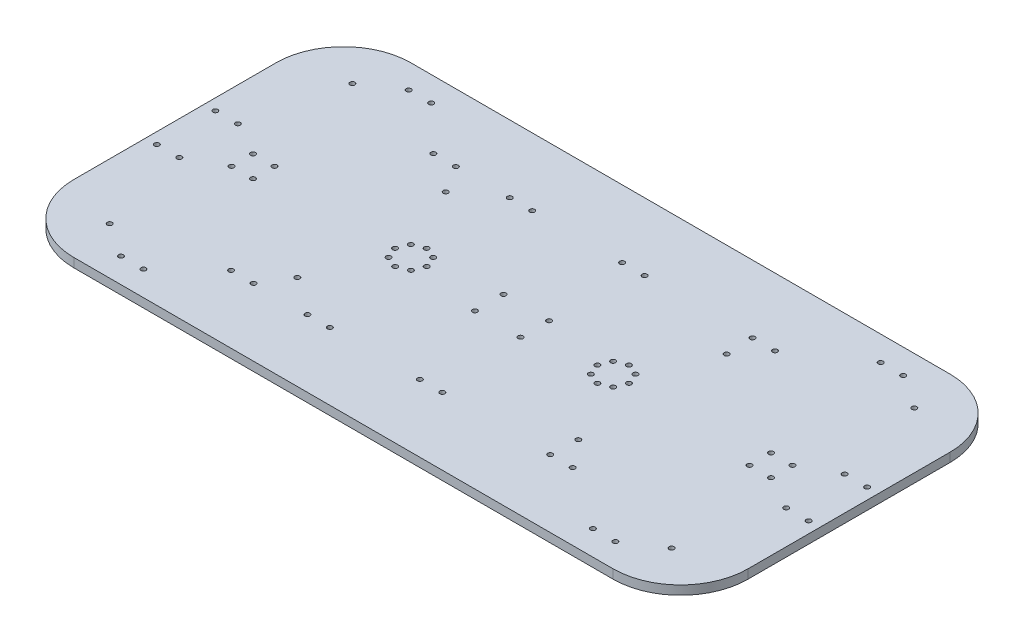
from build123d import *

# Parameters (mm, degrees)
SKETCH_1_W                            = 300
SKETCH_1_H                            = 150
EXTRUDE_1_DEPTH                       = 4
FILLET_4_R                            = 30
FILLET_5_R                            = 30
FILLET_6_R                            = 30
FILLET_7_R                            = 30
HOLE_WIZARD_2_2_2_2_1_D               = 2.2
PATTERN_CIRCULAR_1_COUNT              = 8
MIRROR_1_COPY_1_D                     = 2.2
MIRROR_1_COPY_2_D                     = 2.2
MIRROR_1_COPY_3_D                     = 2.2
MIRROR_1_COPY_4_D                     = 2.2
MIRROR_1_COPY_5_D                     = 2.2
MIRROR_1_COPY_6_D                     = 2.2
MIRROR_1_COPY_7_D                     = 2.2
HOLE_WIZARD_2_2_2_2_2_D               = 2.2
HOLE_WIZARD_2_2_2_2_4_D               = 2.2
F_2_2_2_2_DIAMETER_HOLE1_D            = 2.2
MIRROR_5_AT_THE_SECOND_PLANE_COPY_1_D = 2.2
HOLE_WIZARD_2_2_2_2_6_D               = 2.2
F_2_2_2_2_DIAMETER_HOLE2_D            = 2.2
MIRROR_6_AT_THE_SECOND_PLANE_COPY_1_D = 2.2
F_2_2_2_2_DIAMETER_HOLE3_D            = 2.2
F_2_2_2_2_DIAMETER_HOLE4_D            = 2.2
MIRROR_8_AT_THE_SECOND_PLANE_COPY_1_D = 2.2


with BuildPart() as part:
    # 草图1 → 凸台-拉伸1 (new body)
    with BuildSketch(Plane(origin=(0, 0, 0), x_dir=(1, 0, 0), z_dir=(0, 1, 0))):
        Rectangle(SKETCH_1_W, SKETCH_1_H)
    extrude(amount=EXTRUDE_1_DEPTH)

    # 圆角4
    fillet_4_edges = [part.edges().sort_by_distance(p)[0] for p in [
        (-150, 2, 75),
    ]]
    fillet(fillet_4_edges, radius=FILLET_4_R)

    # 圆角5
    fillet_5_edges = [part.edges().sort_by_distance(p)[0] for p in [
        (-150, 2, -75),
    ]]
    fillet(fillet_5_edges, radius=FILLET_5_R)

    # 圆角6
    fillet_6_edges = [part.edges().sort_by_distance(p)[0] for p in [
        (150, 2, -75),
    ]]
    fillet(fillet_6_edges, radius=FILLET_6_R)

    # 圆角7
    fillet_7_edges = [part.edges().sort_by_distance(p)[0] for p in [
        (150, 2, 75),
    ]]
    fillet(fillet_7_edges, radius=FILLET_7_R)

    # Ø2.2 (2.2) 直径孔1 (through all)
    with Locations(Plane(origin=(0, 0, 0), x_dir=(-1, 0, 0), z_dir=(0, -1, 0))):
        with Locations((45, -7.02)):
            hole_wizard_2_2_2_2_1 = Hole(HOLE_WIZARD_2_2_2_2_1_D / 2)

    # 阵列(圆周)1: Ø2.2 (2.2) 直径孔1 ×8 about axis
    pattern_circular_1_axis = Axis((-45, 0, 0), (0, 1, 0))
    for i in range(1, PATTERN_CIRCULAR_1_COUNT):
        add(hole_wizard_2_2_2_2_1.rotate(pattern_circular_1_axis, i * 360 / PATTERN_CIRCULAR_1_COUNT), mode=Mode.SUBTRACT)

    # 镜向1: Ø2.2 (2.2) 直径孔1 across plane
    add(hole_wizard_2_2_2_2_1.mirror(Plane(origin=(0, 0, 0), x_dir=(0, 0, 1), z_dir=(1, 0, 0))), mode=Mode.SUBTRACT)

    # 镜向1 copy 1 (through all)
    with Locations(Plane(origin=(13.180194847, 0, -31.819805153), x_dir=(0.7071067811865476, 0, 0.7071067811865475), z_dir=(0, -1, 0))):
        with Locations((45, 7.02)):
            Hole(MIRROR_1_COPY_1_D / 2)

    # 镜向1 copy 2 (through all)
    with Locations(Plane(origin=(45, 0, -45), x_dir=(0, 0, 1), z_dir=(0, -1, 0))):
        with Locations((45, 7.02)):
            Hole(MIRROR_1_COPY_2_D / 2)

    # 镜向1 copy 3 (through all)
    with Locations(Plane(origin=(76.819805153, 0, -31.819805153), x_dir=(-0.7071067811865475, 0, 0.7071067811865476), z_dir=(0, -1, 0))):
        with Locations((45, 7.02)):
            Hole(MIRROR_1_COPY_3_D / 2)

    # 镜向1 copy 4 (through all)
    with Locations(Plane(origin=(90, 0, 0), x_dir=(-1, 0, 0), z_dir=(0, -1, 0))):
        with Locations((45, 7.02)):
            Hole(MIRROR_1_COPY_4_D / 2)

    # 镜向1 copy 5 (through all)
    with Locations(Plane(origin=(76.819805153, 0, 31.819805153), x_dir=(-0.7071067811865477, 0, -0.7071067811865475), z_dir=(0, -1, 0))):
        with Locations((45, 7.02)):
            Hole(MIRROR_1_COPY_5_D / 2)

    # 镜向1 copy 6 (through all)
    with Locations(Plane(origin=(45, 0, 45), x_dir=(0, 0, -1), z_dir=(0, -1, 0))):
        with Locations((45, 7.02)):
            Hole(MIRROR_1_COPY_6_D / 2)

    # 镜向1 copy 7 (through all)
    with Locations(Plane(origin=(13.180194847, 0, 31.819805153), x_dir=(0.7071067811865474, 0, -0.7071067811865477), z_dir=(0, -1, 0))):
        with Locations((45, 7.02)):
            Hole(MIRROR_1_COPY_7_D / 2)

    # Ø2.2 (2.2) 直径孔2 (through all)
    with Locations(Plane(origin=(0, 0, 0), x_dir=(-1, 0, 0), z_dir=(0, -1, 0))):
        with Locations((120, 4.78), (120, -4.775), (110.45, -4.775), (110.45, 4.78)):
            hole_wizard_2_2_2_2_2 = Hole(HOLE_WIZARD_2_2_2_2_2_D / 2)

    # 镜向2: Ø2.2 (2.2) 直径孔2 across plane
    add(hole_wizard_2_2_2_2_2.mirror(Plane(origin=(0, 0, 0), x_dir=(0, 0, 1), z_dir=(1, 0, 0))), mode=Mode.SUBTRACT)

    # Ø2.2 (2.2) 直径孔4 (through all)
    with Locations(Plane(origin=(0, 4, 0), x_dir=(1, 0, 0), z_dir=(0, 1, 0))):
        with Locations((100, -64), (110, -64), (-100, -64), (-110, -64)):
            hole_wizard_2_2_2_2_4 = Hole(HOLE_WIZARD_2_2_2_2_4_D / 2)

    # 镜向4: Ø2.2 (2.2) 直径孔4 across plane
    add(hole_wizard_2_2_2_2_4.mirror(Plane.XY), mode=Mode.SUBTRACT)

    # Ø2.2 (2.2) Diameter Hole1 (through all)
    with Locations(Plane(origin=(0, 4, 0), x_dir=(1, 0, 0), z_dir=(0, 1, 0))):
        with Locations((-125, 54)):
            f_2_2_2_2_diameter_hole1 = Hole(F_2_2_2_2_DIAMETER_HOLE1_D / 2)

    # 镜向5: Ø2.2 (2.2) Diameter Hole1 across plane
    add(f_2_2_2_2_diameter_hole1.mirror(Plane(origin=(0, 0, 0), x_dir=(0, 0, 1), z_dir=(1, 0, 0))), mode=Mode.SUBTRACT)

    # 镜向5 at the second plane: Ø2.2 (2.2) Diameter Hole1 across plane
    add(f_2_2_2_2_diameter_hole1.mirror(Plane.XY), mode=Mode.SUBTRACT)

    # 镜向5 at the second plane copy 1 (through all)
    with Locations(Plane(origin=(0, 4, 0), x_dir=(-1, 0, 0), z_dir=(0, 1, 0))):
        with Locations((-125, 54)):
            Hole(MIRROR_5_AT_THE_SECOND_PLANE_COPY_1_D / 2)

    # Ø2.2 (2.2) 直径孔6 (through all)
    with Locations(Plane(origin=(0, 4, 0), x_dir=(1, 0, 0), z_dir=(0, 1, 0))):
        with Locations((-62.5, 33), (-62.5, -33), (62.5, -33), (62.5, 33)):
            Hole(HOLE_WIZARD_2_2_2_2_6_D / 2)

    # Ø2.2 (2.2) Diameter Hole2 (through all)
    with Locations(Plane(origin=(0, 4, 0), x_dir=(1, 0, 0), z_dir=(0, 1, 0))):
        with Locations((-145, 13), (-135, 13)):
            f_2_2_2_2_diameter_hole2 = Hole(F_2_2_2_2_DIAMETER_HOLE2_D / 2)

    # 镜向6: Ø2.2 (2.2) Diameter Hole2 across plane
    add(f_2_2_2_2_diameter_hole2.mirror(Plane(origin=(0, 0, 0), x_dir=(0, 0, 1), z_dir=(1, 0, 0))), mode=Mode.SUBTRACT)

    # 镜向6 at the second plane: Ø2.2 (2.2) Diameter Hole2 across plane
    add(f_2_2_2_2_diameter_hole2.mirror(Plane.XY), mode=Mode.SUBTRACT)

    # 镜向6 at the second plane copy 1 (through all)
    with Locations(Plane(origin=(0, 4, 0), x_dir=(-1, 0, 0), z_dir=(0, 1, 0))):
        with Locations((-145, 13), (-135, 13)):
            Hole(MIRROR_6_AT_THE_SECOND_PLANE_COPY_1_D / 2)

    # Ø2.2 (2.2) Diameter Hole3 (through all)
    with Locations(Plane(origin=(0, 4, 0), x_dir=(1, 0, 0), z_dir=(0, 1, 0))):
        with Locations((-80, 45), (-70, 45), (-46, 45), (-36, 45), (4, 45), (14, 45), (62, 45), (72, 45)):
            f_2_2_2_2_diameter_hole3 = Hole(F_2_2_2_2_DIAMETER_HOLE3_D / 2)

    # 镜向7: Ø2.2 (2.2) Diameter Hole3 across plane
    add(f_2_2_2_2_diameter_hole3.mirror(Plane.XY), mode=Mode.SUBTRACT)

    # Ø2.2 (2.2) Diameter Hole4 (through all)
    with Locations(Plane.XZ):
        with Locations((-10.16, 6.35)):
            f_2_2_2_2_diameter_hole4 = Hole(F_2_2_2_2_DIAMETER_HOLE4_D / 2)

    # 镜向8: Ø2.2 (2.2) Diameter Hole4 across plane
    add(f_2_2_2_2_diameter_hole4.mirror(Plane.XY), mode=Mode.SUBTRACT)

    # 镜向8 at the second plane: Ø2.2 (2.2) Diameter Hole4 across plane
    add(f_2_2_2_2_diameter_hole4.mirror(Plane(origin=(0, 0, 0), x_dir=(0, 0, 1), z_dir=(1, 0, 0))), mode=Mode.SUBTRACT)

    # 镜向8 at the second plane copy 1 (through all)
    with Locations(Plane(origin=(0, 0, 0), x_dir=(-1, 0, 0), z_dir=(0, -1, 0))):
        with Locations((-10.16, 6.35)):
            Hole(MIRROR_8_AT_THE_SECOND_PLANE_COPY_1_D / 2)


solid = part.part
